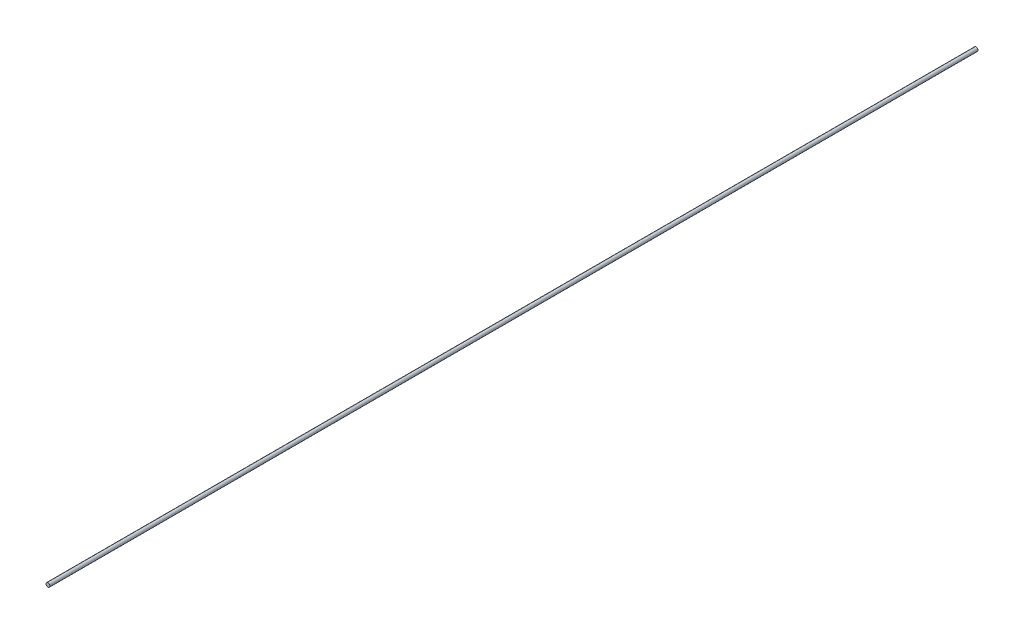
from build123d import *

# Parameters (mm, degrees)
SKETCH1_R           = 1.5875
BOSS_EXTRUDE1_DEPTH = 762


with BuildPart() as part:
    # Sketch1 → Boss-Extrude1 (new body)
    with BuildSketch(Plane.XY):
        Circle(SKETCH1_R)
    extrude(amount=BOSS_EXTRUDE1_DEPTH)


solid = part.part
